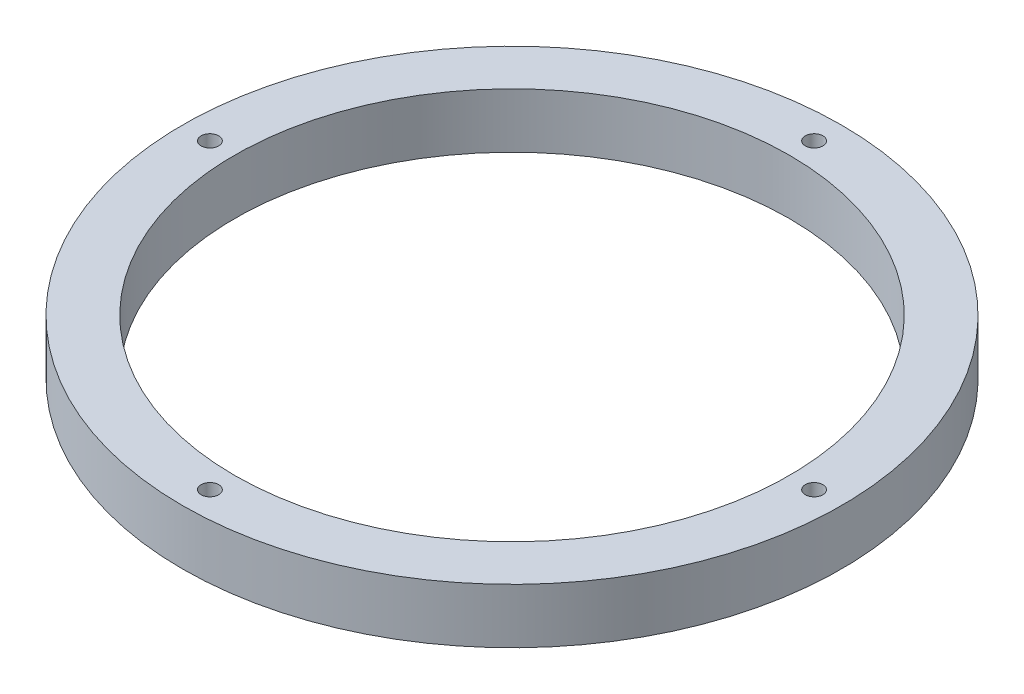
from build123d import *

# Parameters (mm, degrees)
SKETCH_1_R      = 60
SKETCH_1_R_2    = 50.5
SKETCH_1_R_3    = 1.6
EXTRUDE_1_DEPTH = 10


with BuildPart() as part:
    # 草图1 → 凸台-拉伸1 (new body)
    with BuildSketch(Plane(origin=(0, 0, 0), x_dir=(1, 0, 0), z_dir=(0, 1, 0))):
        with Locations(Location((0, 0, 0), (0, 0, 270))):
            Circle(SKETCH_1_R)
        with Locations(Location((0, 0, 0), (0, 0, 270))):
            Circle(SKETCH_1_R_2, mode=Mode.SUBTRACT)
        with Locations(Location((0, 55, 0), (0, 0, 270))):
            Circle(SKETCH_1_R_3, mode=Mode.SUBTRACT)
        with Locations(Location((55, 0, 0), (0, 0, 270))):
            Circle(SKETCH_1_R_3, mode=Mode.SUBTRACT)
        with Locations(Location((0, -55, 0), (0, 0, 270))):
            Circle(SKETCH_1_R_3, mode=Mode.SUBTRACT)
        with Locations(Location((-55, 0, 0), (0, 0, 270))):
            Circle(SKETCH_1_R_3, mode=Mode.SUBTRACT)
    extrude(amount=EXTRUDE_1_DEPTH)


solid = part.part
